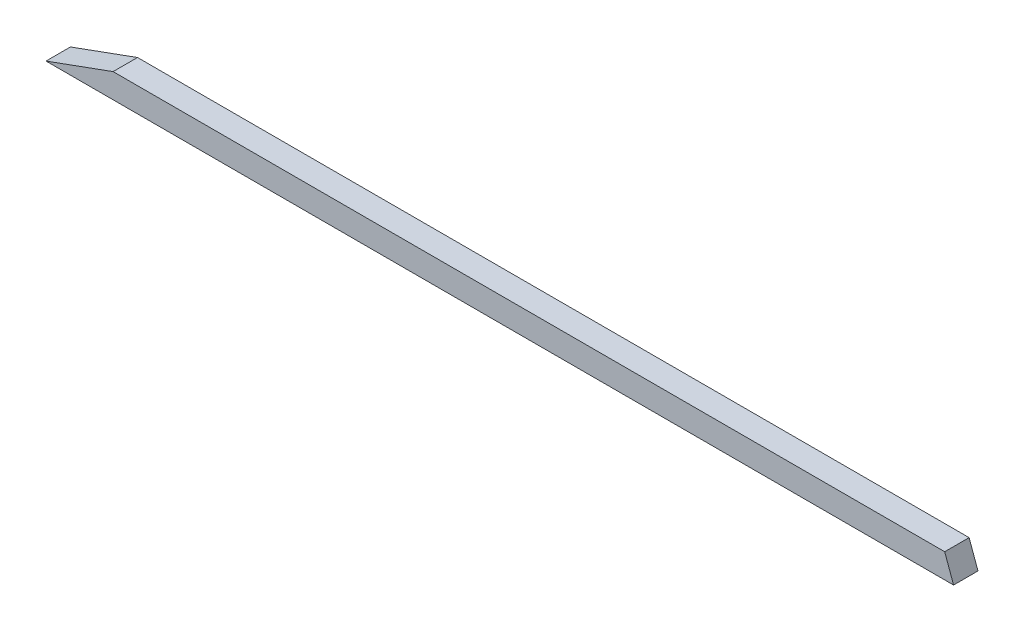
from build123d import *

# Parameters (mm, degrees)
SKETCH1_W               = 987.806
SKETCH1_H               = 20
BOSS_EXTRUDE1_DEPTH     = 20
CUT_EXTRUDE1_DEPTH      = 20
CUT_EXTRUDE4_DEPTH      = 989.210854846
CUT_EXTRUDE5_DEPTH      = 989.210854846
CUT_EXTRUDE5_DEPTH_BACK = 989.210854846
CUT_EXTRUDE9_DEPTH      = 768.684470274


with BuildPart() as part:
    # Sketch1 → Boss-Extrude1 (new body)
    with BuildSketch(Plane.XY):
        with Locations((493.903, 10)):
            Rectangle(SKETCH1_W, SKETCH1_H)
    extrude(amount=BOSS_EXTRUDE1_DEPTH)

    # Sketch2 → Cut-Extrude1 (cut)
    with BuildSketch(Plane.XY.offset(20)):
        Polygon((0, 20), (0, 0), (54.949548389, 20), align=None)
    extrude(amount=-CUT_EXTRUDE1_DEPTH, mode=Mode.SUBTRACT)

    # Sketch5 → Cut-Extrude4 (cut, through all)
    with BuildSketch(Plane.XY.offset(20)):
        Polygon((987.806, 20), (980.526595315, 0), (987.806, 0), align=None)
    extrude(amount=-CUT_EXTRUDE4_DEPTH, mode=Mode.SUBTRACT)

    # Sketch7 → Cut-Extrude5 (cut, two sides: drawn at the far end of the back side and taken through both)
    with BuildSketch(Plane.XY.offset(20).offset(-CUT_EXTRUDE5_DEPTH_BACK)):
        Polygon((743.328174074, 0), (980.526595315, 0), (987.806, 20), (767.163245926, 20), align=None)
    extrude(amount=CUT_EXTRUDE5_DEPTH + CUT_EXTRUDE5_DEPTH_BACK, mode=Mode.SUBTRACT)

    # Sketch8 → Cut-Extrude9 (cut, through all)
    with BuildSketch(Plane.XY.offset(20)):
        Polygon((743.328174074, 0), (736.048769389, 20), (767.163245926, 20), align=None)
    extrude(amount=-CUT_EXTRUDE9_DEPTH, mode=Mode.SUBTRACT)


solid = part.part
